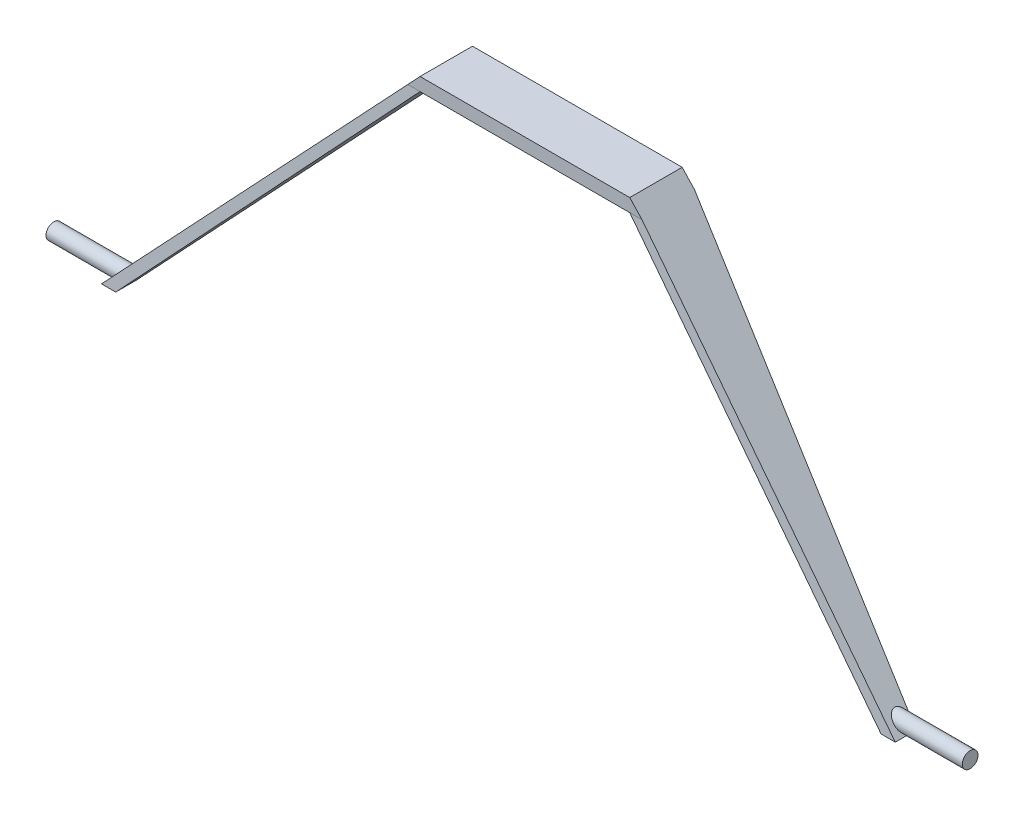
from build123d import *

# Parameters (mm, degrees)
BOSS_EXTRUDE6_DEPTH              = 53.34
BOSS_EXTRUDE6_DEPTH_BACK         = 101.6
CUT_EXTRUDE8_REACH               = 902.262
CUT_EXTRUDE8_DIRECTION_2_REACH   = 902.262
SKETCH15_R                       = 19.05
BOSS_EXTRUDE8_DEPTH              = 127
CUT_EXTRUDE9_REACH               = 1709.816
SKETCH16_W                       = 38.1
SKETCH16_H                       = 10.414
CUT_EXTRUDE9_DIRECTION_2_REACH   = 1709.816
SKETCH17_R                       = 15.24
BOSS_EXTRUDE9_DEPTH              = 127
BOSS_EXTRUDE9_DIRECTION_2_REACH  = 1707.258
SKETCH18_R                       = 15.24
BOSS_EXTRUDE10_DEPTH             = 127
BOSS_EXTRUDE10_DIRECTION_2_REACH = 1704.799
CUT_EXTRUDE10_REACH              = 1704.799
CUT_EXTRUDE10_DIRECTION_2_REACH  = 1704.799


with BuildPart() as part:
    # Sketch12 → Boss-Extrude6 (new, two sides: drawn at the far end of the back side and taken through both)
    with BuildSketch(Plane.XY.offset(-BOSS_EXTRUDE6_DEPTH_BACK)):
        Polygon((-203.2, 241.3), (203.2, 241.3), (787.471663752, -383.669201703), (787.471663752, -424.309201703), (762.071663752, -424.309201703), (762.071663752, -386.209201703), (203.2, 215.9), (-203.2, 215.9), (-762.071663752, -386.209201703), (-762.071663752, -424.309201703), (-787.471663752, -424.309201703), (-787.471663752, -383.669201703), align=None)
    extrude(amount=BOSS_EXTRUDE6_DEPTH + BOSS_EXTRUDE6_DEPTH_BACK)

    # Cut-Extrude8: up to this plane
    cut_extrude8_end = Plane(origin=(-203.2, 241.3, -101.6), z_dir=(-0.7304911811601322, 0.6829221289775833, 0))
    # Sketch14 → Cut-Extrude8 (cut, up to the surface)
    with BuildSketch(Plane(origin=(0, 0, 0), x_dir=(0, 0, -1), z_dir=(1, 0, 0)), mode=Mode.PRIVATE) as cut_extrude8_sk1:
        Polygon((0, 241.3), (0, 215.9), (-53.34, -386.209201703), (-53.34, 241.3), align=None)
    cut_extrude8_tool1 = split(extrude(cut_extrude8_sk1.sketch, amount=-CUT_EXTRUDE8_REACH, mode=Mode.PRIVATE), bisect_by=cut_extrude8_end, keep=Keep.BOTH, mode=Mode.PRIVATE)
    add(cut_extrude8_tool1.solids().sort_by_distance((0, 31.800889, 34.868308))[0], mode=Mode.SUBTRACT)
    # Sketch14 → Cut-Extrude8 (cut, up to the surface)
    with BuildSketch(Plane(origin=(0, 0, 0), x_dir=(0, 0, -1), z_dir=(1, 0, 0)), mode=Mode.PRIVATE) as cut_extrude8_sk2:
        Polygon((101.6, 215.9), (-15.24, -386.209201703), (-15.24, -424.309201703), (101.6, -424.309201703), align=None)
    cut_extrude8_tool2 = split(extrude(cut_extrude8_sk2.sketch, amount=-CUT_EXTRUDE8_REACH, mode=Mode.PRIVATE), bisect_by=cut_extrude8_end, keep=Keep.BOTH, mode=Mode.PRIVATE)
    add(cut_extrude8_tool2.solids().sort_by_distance((0, -210.192787, -60.465735))[0], mode=Mode.SUBTRACT)

    # Cut-Extrude8 direction 2: up to this plane
    cut_extrude8_direction_2_end = Plane(origin=(203.2, 241.3, -101.6), z_dir=(0.7304911811601321, 0.6829221289775835, 0))
    # Sketch14 → Cut-Extrude8 direction 2 (cut, up to the surface)
    with BuildSketch(Plane(origin=(0, 0, 0), x_dir=(0, 0, -1), z_dir=(1, 0, 0)), mode=Mode.PRIVATE) as cut_extrude8_direction_2_sk1:
        Polygon((0, 241.3), (0, 215.9), (-53.34, -386.209201703), (-53.34, 241.3), align=None)
    cut_extrude8_direction_2_tool1 = split(extrude(cut_extrude8_direction_2_sk1.sketch, amount=CUT_EXTRUDE8_DIRECTION_2_REACH, mode=Mode.PRIVATE), bisect_by=cut_extrude8_direction_2_end, keep=Keep.BOTH, mode=Mode.PRIVATE)
    add(cut_extrude8_direction_2_tool1.solids().sort_by_distance((0, 31.800889, 34.868308))[0], mode=Mode.SUBTRACT)
    # Sketch14 → Cut-Extrude8 direction 2 (cut, up to the surface)
    with BuildSketch(Plane(origin=(0, 0, 0), x_dir=(0, 0, -1), z_dir=(1, 0, 0)), mode=Mode.PRIVATE) as cut_extrude8_direction_2_sk2:
        Polygon((101.6, 215.9), (-15.24, -386.209201703), (-15.24, -424.309201703), (101.6, -424.309201703), align=None)
    cut_extrude8_direction_2_tool2 = split(extrude(cut_extrude8_direction_2_sk2.sketch, amount=CUT_EXTRUDE8_DIRECTION_2_REACH, mode=Mode.PRIVATE), bisect_by=cut_extrude8_direction_2_end, keep=Keep.BOTH, mode=Mode.PRIVATE)
    add(cut_extrude8_direction_2_tool2.solids().sort_by_distance((0, -210.192787, -60.465735))[0], mode=Mode.SUBTRACT)

    # Sketch15 → Boss-Extrude8 (add)
    with BuildSketch(Plane.ZY.offset(762.071663752)):
        with Locations((34.29, -394.845201703)):
            Circle(SKETCH15_R)
    boss_extrude8 = extrude(amount=BOSS_EXTRUDE8_DEPTH)

    # Mirror2: Boss-Extrude8 across plane
    add(boss_extrude8.mirror(Plane(origin=(0, 0, 0), x_dir=(0, 0, 1), z_dir=(1, 0, 0))))

    # Cut-Extrude9: up to this face of the body (flat: up to its plane)
    cut_extrude9_end = Plane(part.part.faces().sort_by_distance((-787.471663752, -416.434815963, 34.29))[0])
    # Sketch16 → Cut-Extrude9 (cut, up to the picked face)
    with BuildSketch(Plane.ZY.offset(762.071663752), mode=Mode.PRIVATE) as cut_extrude9_sk1:
        with Locations((34.29, -419.102201703)):
            Rectangle(SKETCH16_W, SKETCH16_H)
    cut_extrude9_tool1 = split(extrude(cut_extrude9_sk1.sketch, amount=CUT_EXTRUDE9_REACH, mode=Mode.PRIVATE), bisect_by=cut_extrude9_end, keep=Keep.BOTH, mode=Mode.PRIVATE)
    add(cut_extrude9_tool1.solids().sort_by(Axis((-762.071664, -419.102202, 34.29), (-1, 0, 0)))[0], mode=Mode.SUBTRACT)

    # Cut-Extrude9 direction 2: up to this face of the body (flat: up to its plane)
    cut_extrude9_direction_2_end = Plane(part.part.faces().sort_by_distance((787.471663752, -416.434815963, 34.29))[0])
    # Sketch16 → Cut-Extrude9 direction 2 (cut, up to the picked face)
    with BuildSketch(Plane.ZY.offset(762.071663752), mode=Mode.PRIVATE) as cut_extrude9_direction_2_sk1:
        with Locations((34.29, -419.102201703)):
            Rectangle(SKETCH16_W, SKETCH16_H)
    cut_extrude9_direction_2_tool1 = split(extrude(cut_extrude9_direction_2_sk1.sketch, amount=-CUT_EXTRUDE9_DIRECTION_2_REACH, mode=Mode.PRIVATE), bisect_by=cut_extrude9_direction_2_end, keep=Keep.BOTH, mode=Mode.PRIVATE)
    add(cut_extrude9_direction_2_tool1.solids().sort_by(Axis((-762.071664, -419.102202, 34.29), (1, 0, 0)))[0], mode=Mode.SUBTRACT)

    # Sketch17 → Boss-Extrude9 (add)
    with BuildSketch(Plane.ZY.offset(762.071663752)):
        with Locations((23.742517108, -348.871201703)):
            Circle(SKETCH17_R)
    extrude(amount=BOSS_EXTRUDE9_DEPTH)

    # Boss-Extrude9 direction 2: up to this face of the body (flat: up to its plane)
    boss_extrude9_direction_2_end = Plane(part.part.faces().sort_by_distance((-449.243763763, -21.881982223, -17.095411005))[0])
    # Sketch17 → Boss-Extrude9 direction 2 (add, up to the picked face)
    with BuildSketch(Plane.ZY.offset(762.071663752), mode=Mode.PRIVATE) as boss_extrude9_direction_2_sk1:
        with Locations((23.742517108, -348.871201703)):
            Circle(SKETCH17_R)
    boss_extrude9_direction_2_tool1 = split(extrude(boss_extrude9_direction_2_sk1.sketch, amount=-BOSS_EXTRUDE9_DIRECTION_2_REACH, mode=Mode.PRIVATE), bisect_by=boss_extrude9_direction_2_end, keep=Keep.BOTH, mode=Mode.PRIVATE)
    add(boss_extrude9_direction_2_tool1.solids().sort_by(Axis((-762.071664, -348.871202, 23.742517), (1, 0, 0)))[0])

    # Sketch18 → Boss-Extrude10 (add)
    with BuildSketch(Plane.ZY.offset(-759.531663752)):
        with Locations(Location((23.689446508, -348.597714057, 0), (0, 0, 270))):
            Circle(SKETCH18_R)
    extrude(amount=-BOSS_EXTRUDE10_DEPTH)

    # Boss-Extrude10 direction 2: up to this face of the body (flat: up to its plane)
    boss_extrude10_direction_2_end = Plane(part.part.faces().sort_by_distance((449.243763763, -21.881982223, -17.095411005))[0])
    # Sketch18 → Boss-Extrude10 direction 2 (add, up to the picked face)
    with BuildSketch(Plane.ZY.offset(-759.531663752), mode=Mode.PRIVATE) as boss_extrude10_direction_2_sk1:
        with Locations(Location((23.689446508, -348.597714057, 0), (0, 0, 270))):
            Circle(SKETCH18_R)
    boss_extrude10_direction_2_tool1 = split(extrude(boss_extrude10_direction_2_sk1.sketch, amount=BOSS_EXTRUDE10_DIRECTION_2_REACH, mode=Mode.PRIVATE), bisect_by=boss_extrude10_direction_2_end, keep=Keep.BOTH, mode=Mode.PRIVATE)
    add(boss_extrude10_direction_2_tool1.solids().sort_by(Axis((759.531664, -348.597714, 23.689447), (-1, 0, 0)))[0])

    # Cut-Extrude10: up to this face of the body (flat: up to its plane)
    cut_extrude10_end = Plane(part.part.faces().sort_by_distance((889.071663752, -394.845201703, 34.29))[0])
    # Sketch19 → Cut-Extrude10 (cut, up to the picked face)
    with BuildSketch(Plane.ZY.offset(-759.531663752), mode=Mode.PRIVATE) as cut_extrude10_sk1:
        Polygon((53.34, -413.895201703), (53.34, -364.111201703), (10.015366078, -364.111201703), (9.719632082, -413.895201703), (10.311100074, -413.895201703), align=None)
    cut_extrude10_tool1 = split(extrude(cut_extrude10_sk1.sketch, amount=-CUT_EXTRUDE10_REACH, mode=Mode.PRIVATE), bisect_by=cut_extrude10_end, keep=Keep.BOTH, mode=Mode.PRIVATE)
    add(cut_extrude10_tool1.solids().sort_by(Axis((759.531664, -389.031424, 31.603666), (1, 0, 0)))[0], mode=Mode.SUBTRACT)

    # Cut-Extrude10 direction 2: up to this face of the body (flat: up to its plane)
    cut_extrude10_direction_2_end = Plane(part.part.faces().sort_by_distance((-889.071663752, -394.845201703, 34.29))[0])
    # Sketch19 → Cut-Extrude10 direction 2 (cut, up to the picked face)
    with BuildSketch(Plane.ZY.offset(-759.531663752), mode=Mode.PRIVATE) as cut_extrude10_direction_2_sk1:
        Polygon((53.34, -413.895201703), (53.34, -364.111201703), (10.015366078, -364.111201703), (9.719632082, -413.895201703), (10.311100074, -413.895201703), align=None)
    cut_extrude10_direction_2_tool1 = split(extrude(cut_extrude10_direction_2_sk1.sketch, amount=CUT_EXTRUDE10_DIRECTION_2_REACH, mode=Mode.PRIVATE), bisect_by=cut_extrude10_direction_2_end, keep=Keep.BOTH, mode=Mode.PRIVATE)
    add(cut_extrude10_direction_2_tool1.solids().sort_by(Axis((759.531664, -389.031424, 31.603666), (-1, 0, 0)))[0], mode=Mode.SUBTRACT)


solid = part.part
